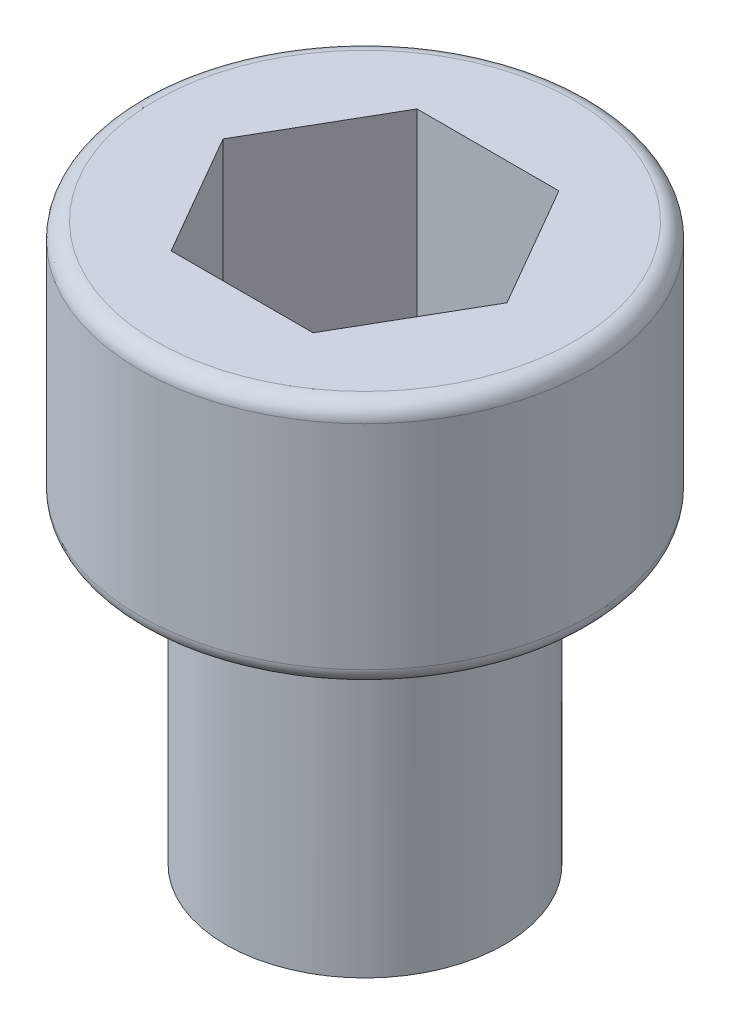
from build123d import *

# Parameters (mm, degrees)
FILLET1_R          = 0.254
CUT_EXTRUDE1_DEPTH = 3.81


with BuildPart() as part:
    # Sketch1 → Revolve1 (revolve)
    with BuildSketch(Plane.XY, mode=Mode.PRIVATE) as revolve1_sk:
        Polygon((2.159, 0), (2.159, 4.826), (3.4925, 4.826), (3.4925, 8.636), (0, 8.636), (0, 0), align=None)
    revolve(revolve1_sk.sketch.rotate(Axis((0, 0, 0), (0, -1, 0)), 90), axis=Axis((0, 0, 0), (0, -1, 0)))

    # Fillet1
    fillet1_edges = [part.edges().sort_by_distance(p)[0] for p in [
        (0, 8.636, -3.4925),
        (0, 4.826, -3.4925),
    ]]
    fillet(fillet1_edges, radius=FILLET1_R)

    # Sketch2 → Cut-Extrude1 (cut)
    with BuildSketch(Plane(origin=(0, 8.636, 0), x_dir=(1, 0, 0), z_dir=(0, 1, 0))):
        Polygon((1.099852263, 1.905), (-1.099852263, 1.905), (-2.199704526, 0), (-1.099852263, -1.905), (1.099852263, -1.905), (2.199704526, 0), align=None)
    extrude(amount=-CUT_EXTRUDE1_DEPTH, mode=Mode.SUBTRACT)


solid = part.part
